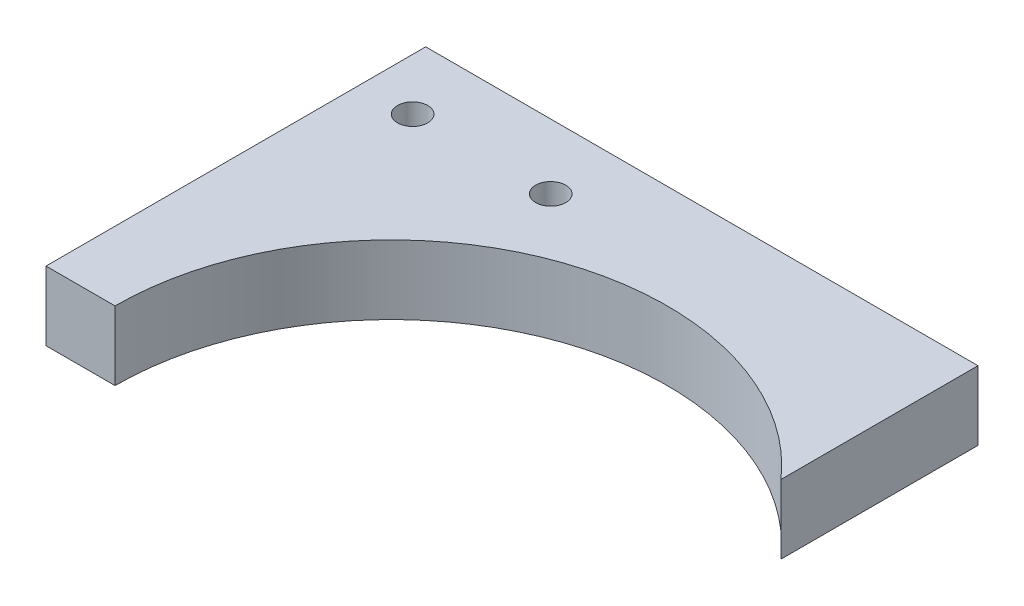
from build123d import *

# Parameters (mm, degrees)
SKETCH1_W           = 304.8
SKETCH1_H           = 304.8
BOSS_EXTRUDE1_DEPTH = 6.35
CUT_EXTRUDE1_DEPTH  = 432.099063441
SKETCH3_R           = 25.4
CUT_EXTRUDE2_DEPTH  = 310.0695755
SKETCH4_R           = 1.3890625
CUT_EXTRUDE3_DEPTH  = 310.0695755


with BuildPart() as part:
    # Sketch1 → Boss-Extrude1 (new body)
    with BuildSketch(Plane(origin=(0, 0, 0), x_dir=(1, 0, 0), z_dir=(0, 1, 0))):
        with Locations((152.4, 152.4)):
            Rectangle(SKETCH1_W, SKETCH1_H)
    extrude(amount=BOSS_EXTRUDE1_DEPTH)

    # Sketch2 → Cut-Extrude1 (cut, through all)
    with BuildSketch(Plane(origin=(0, 6.35, 0), x_dir=(1, 0, 0), z_dir=(0, 1, 0))):
        Polygon((50.8, 304.8), (50.8, 269.875), (0, 269.875), (0, 0), (304.8, 0), (304.8, 304.8), align=None)
    extrude(amount=-CUT_EXTRUDE1_DEPTH, mode=Mode.SUBTRACT)

    # Sketch3 → Cut-Extrude2 (cut, through all)
    with BuildSketch(Plane(origin=(0, 6.35, 0), x_dir=(1, 0, 0), z_dir=(0, 1, 0))):
        with Locations((31.75, 269.875)):
            Circle(SKETCH3_R)
    extrude(amount=-CUT_EXTRUDE2_DEPTH, mode=Mode.SUBTRACT)

    # Sketch4 → Cut-Extrude3 (cut, through all)
    with BuildSketch(Plane(origin=(0, 6.35, 0), x_dir=(1, 0, 0), z_dir=(0, 1, 0))):
        with Locations(Location((4.7625, 298.833465882, 0), (0, 0, 270))):
            Circle(SKETCH4_R)
        with Locations(Location((17.4625, 298.833465882, 0), (0, 0, 270))):
            Circle(SKETCH4_R)
    extrude(amount=-CUT_EXTRUDE3_DEPTH, mode=Mode.SUBTRACT)


solid = part.part
